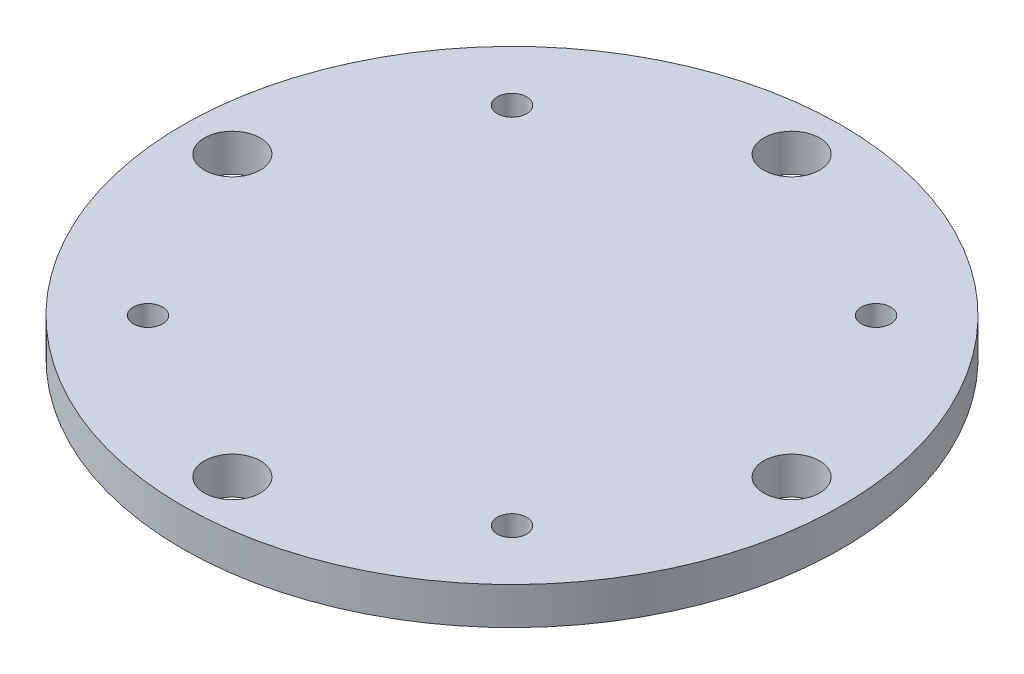
from build123d import *

# Parameters (mm, degrees)
SKETCH1_R                 = 28.063300378
BOSS_EXTRUDE1_DEPTH       = 3.175
M3X0_5_TAPPED_HOLE1_D     = 2.5
M3X0_5_TAPPED_HOLE1_DEPTH = 7.62
M3X0_5_TAPPED_HOLE1_TIP   = 0.751075774
SKETCH5_R                 = 2.38125
CUT_EXTRUDE1_DEPTH        = 40.814297448
CIRPATTERN1_COUNT         = 4


with BuildPart() as part:
    # Sketch1 → Boss-Extrude1 (new body)
    with BuildSketch(Plane(origin=(0, 0, 0), x_dir=(1, 0, 0), z_dir=(0, 1, 0))):
        with Locations(Location((0, 0, 0), (0, 0, 270))):
            Circle(SKETCH1_R)
    extrude(amount=BOSS_EXTRUDE1_DEPTH)

    # M3x0.5 Tapped Hole1
    with Locations(Plane(origin=(0, 3.175, 0), x_dir=(1, 0, 0), z_dir=(0, 1, 0))):
        with Locations((-15.5, 15.5), (15.5, -15.5), (15.5, 15.5), (-15.5, -15.5)):
            Hole(M3X0_5_TAPPED_HOLE1_D / 2, depth=M3X0_5_TAPPED_HOLE1_DEPTH)
            with Locations((0, 0, -(M3X0_5_TAPPED_HOLE1_DEPTH + M3X0_5_TAPPED_HOLE1_TIP / 2))):  # 118° drill point
                Cone(0, M3X0_5_TAPPED_HOLE1_D / 2, M3X0_5_TAPPED_HOLE1_TIP, mode=Mode.SUBTRACT)

    # Sketch5 → Cut-Extrude1 (cut, through all)
    with BuildSketch(Plane(origin=(0, 3.175, 0), x_dir=(1, 0, 0), z_dir=(0, 1, 0))):
        with Locations(Location((0, 23.8125, 0), (0, 0, 270))):
            Circle(SKETCH5_R)
    cut_extrude1 = extrude(amount=-CUT_EXTRUDE1_DEPTH, mode=Mode.SUBTRACT)

    # CirPattern1: Cut-Extrude1 ×4 about axis
    cirpattern1_axis = Axis((0, 0, 0), (0, 1, 0))
    for i in range(1, CIRPATTERN1_COUNT):
        add(cut_extrude1.rotate(cirpattern1_axis, i * 360 / CIRPATTERN1_COUNT), mode=Mode.SUBTRACT)


solid = part.part
